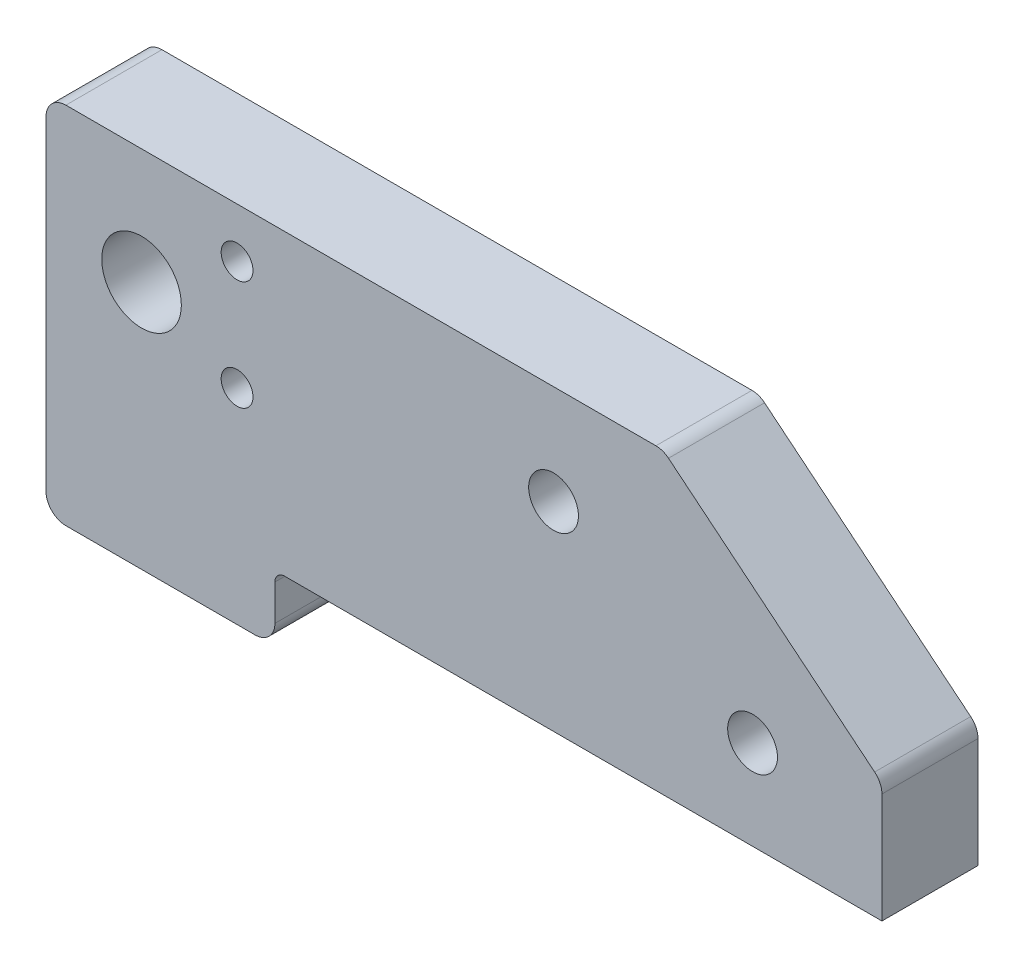
from build123d import *

# Parameters (mm, degrees)
BOSS_EXTRUDE1_DEPTH             = 4.826
M3X0_5_TAPPED_HOLE1_D           = 2.5
TAP_DRILL_FOR_M3X0_5_TAP1_D     = 2.5
TAP_DRILL_FOR_M3X0_5_TAP1_DEPTH = 5
TAP_DRILL_FOR_M3X0_5_TAP1_TIP   = 0.751075774
M3X0_5_TAPPED_HOLE2_D           = 2.5
SKETCH1_3_R                     = 2
BOSS_EXTRUDE2_DEPTH             = 4.826
FILLET1_R                       = 1
M2_TAPPED_HOLES_D               = 1.6
FILLET2_R                       = 0.5


with BuildPart() as part:
    # Sketch1 → Boss-Extrude1 (new body)
    with BuildSketch(Plane.XY):
        Polygon((11, 0), (0, 0), (-11, 0), (-11, 15), (0, 15), (11, 6), align=None)
    extrude(amount=BOSS_EXTRUDE1_DEPTH)

    # M3x0.5 Tapped Hole1 (through all)
    with Locations(Plane.XY.offset(4.826)):
        with Locations((-5.5, 10)):
            Hole(M3X0_5_TAPPED_HOLE1_D / 2)

    # Tap Drill for M3x0.5 Tap1
    with Locations(Plane(origin=(-4, 0, 2.413), x_dir=(-1, 0, 0), z_dir=(0, -1, 0))):
        with Locations((0, 0), (-12, 0)):
            Hole(TAP_DRILL_FOR_M3X0_5_TAP1_D / 2, depth=TAP_DRILL_FOR_M3X0_5_TAP1_DEPTH)
            with Locations((0, 0, -(TAP_DRILL_FOR_M3X0_5_TAP1_DEPTH + TAP_DRILL_FOR_M3X0_5_TAP1_TIP / 2))):  # 118° drill point
                Cone(0, TAP_DRILL_FOR_M3X0_5_TAP1_D / 2, TAP_DRILL_FOR_M3X0_5_TAP1_TIP, mode=Mode.SUBTRACT)

    # M3x0.5 Tapped Hole2 (through all)
    with Locations(Plane(origin=(4.5, 4.5, 4.826), x_dir=(1, 0, 0), z_dir=(0, 0, 1))):
        with Locations((0, 0)):
            Hole(M3X0_5_TAPPED_HOLE2_D / 2)

    # Sketch1<3> → Boss-Extrude2 (add)
    with BuildSketch(Plane.XY):
        Polygon((-19.5, 0), (-11, 0), (-11, 15), (-19.5, 15), (-31, 15), (-31, -3.3), (-19.5, -3.3), align=None)
        with Locations((-26.2, 9.2)):
            Circle(SKETCH1_3_R, mode=Mode.SUBTRACT)
    extrude(amount=BOSS_EXTRUDE2_DEPTH)

    # Fillet1
    fillet1_edges = [part.edges().sort_by_distance(p)[0] for p in [
        (0, 15, 2.413),
        (11, 6, 2.413),
        (-31, 15, 2.413),
        (-31, -3.3, 2.413),
        (-19.5, -3.3, 2.413),
    ]]
    fillet(fillet1_edges, radius=FILLET1_R)

    # M2 Tapped Holes (through all)
    with Locations(Plane.XY.offset(4.826)):
        with Locations((-21.4, 12.5), (-21.4, 7)):
            Hole(M2_TAPPED_HOLES_D / 2)

    # Fillet2
    fillet2_edges = [part.edges().sort_by_distance(p)[0] for p in [
        (-19.5, 0, 2.413),
    ]]
    fillet(fillet2_edges, radius=FILLET2_R)


solid = part.part
